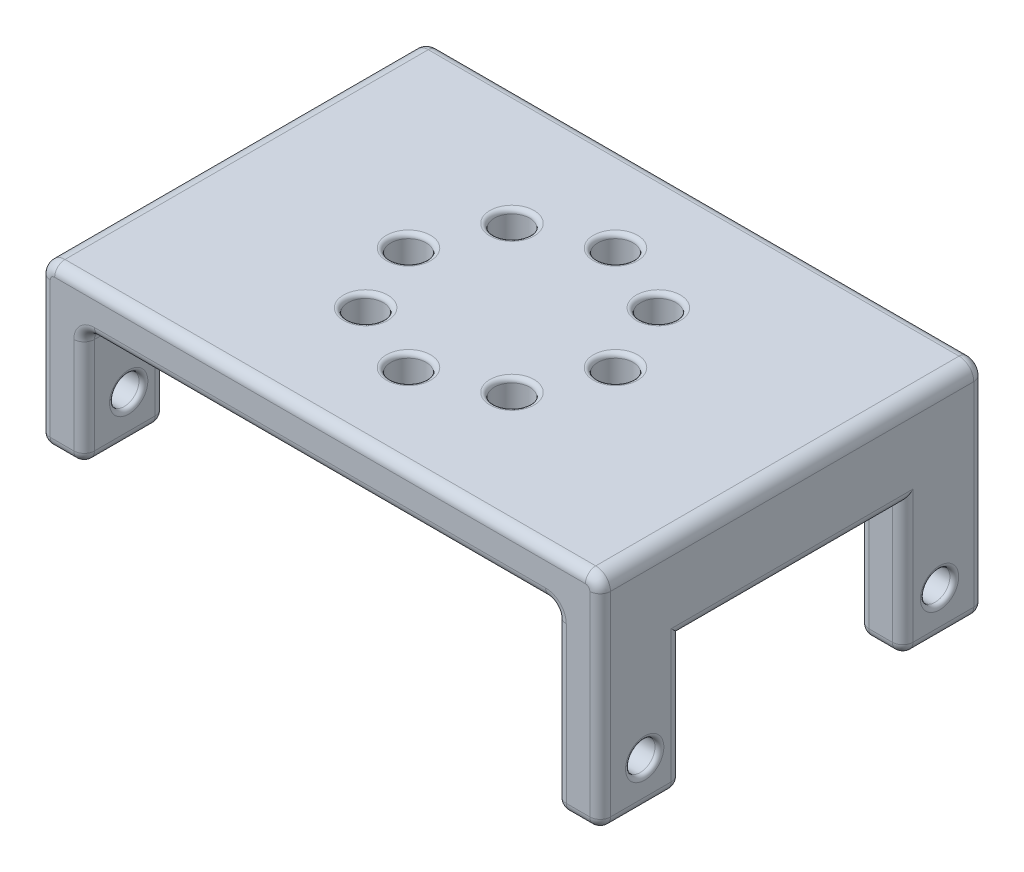
from build123d import *

# Parameters (mm, degrees)
SKETCH1_W           = 38
SKETCH1_H           = 24.04
SKETCH1_R           = 1.2
BOSS_EXTRUDE1_DEPTH = 3
SKETCH2_R           = 1
BOSS_EXTRUDE2_DEPTH = 3
SKETCH3_R           = 1
BOSS_EXTRUDE3_DEPTH = 3
EXTRUDE_1_DEPTH     = 1
EXTRUDE_2_DEPTH     = 1
FILLET_1_R          = 1
FILLET_2_R          = 1
FILLET_3_R          = 0.7
FILLET_4_R          = 0.3


with BuildPart() as part:
    # Sketch1 → Boss-Extrude1 (new body)
    with BuildSketch(Plane(origin=(0, 0, 0), x_dir=(1, 0, 0), z_dir=(0, 1, 0))):
        Rectangle(SKETCH1_W, SKETCH1_H)
        with Locations(Location((0, 7.02, 0), (0, 0, 270))):
            Circle(SKETCH1_R, mode=Mode.SUBTRACT)
        with Locations(Location((4.963889604, 4.963889604, 0), (0, 0, 270))):
            Circle(SKETCH1_R, mode=Mode.SUBTRACT)
        with Locations(Location((7.02, 0, 0), (0, 0, 270))):
            Circle(SKETCH1_R, mode=Mode.SUBTRACT)
        with Locations(Location((4.963889604, -4.963889604, 0), (0, 0, 270))):
            Circle(SKETCH1_R, mode=Mode.SUBTRACT)
        with Locations(Location((0, -7.02, 0), (0, 0, 270))):
            Circle(SKETCH1_R, mode=Mode.SUBTRACT)
        with Locations(Location((-4.963889604, -4.963889604, 0), (0, 0, 270))):
            Circle(SKETCH1_R, mode=Mode.SUBTRACT)
        with Locations(Location((-7.02, 0, 0), (0, 0, 270))):
            Circle(SKETCH1_R, mode=Mode.SUBTRACT)
        with Locations(Location((-4.963889604, 4.963889604, 0), (0, 0, 270))):
            Circle(SKETCH1_R, mode=Mode.SUBTRACT)
    extrude(amount=BOSS_EXTRUDE1_DEPTH)

    # Sketch2 → Boss-Extrude2 (add)
    # profile 1 of 2: a face of its own
    with BuildSketch(Plane(origin=(19, 0, 0), x_dir=(0, 0, -1), z_dir=(1, 0, 0))):
        Polygon((-7.5, -2.95), (0, -2.95), (0, 0), (-12.02, 0), (-12.02, -11.95), (-7.5, -11.95), align=None)
        with Locations((-10, -8.95)):
            Circle(SKETCH2_R, mode=Mode.SUBTRACT)
    # profile 2 of 2: a face of its own
    with BuildSketch(Plane(origin=(19, 0, 0), x_dir=(0, 0, -1), z_dir=(1, 0, 0))):
        Polygon((7.5, -2.95), (7.5, -11.95), (12.02, -11.95), (12.02, 0), (0, 0), (0, -2.95), align=None)
        with Locations((10, -8.95)):
            Circle(SKETCH2_R, mode=Mode.SUBTRACT)
    extrude(amount=-BOSS_EXTRUDE2_DEPTH)

    # Sketch3 → Boss-Extrude3 (add)
    # profile 1 of 2: a face of its own
    with BuildSketch(Plane.ZY.offset(19)):
        Polygon((-7.5, -2.95), (0, -2.95), (0, 0), (-12.02, 0), (-12.02, -7.95), (-7.5, -7.95), align=None)
        with Locations((-10, -4.95)):
            Circle(SKETCH3_R, mode=Mode.SUBTRACT)
    # profile 2 of 2: a face of its own
    with BuildSketch(Plane.ZY.offset(19)):
        Polygon((7.5, -2.95), (7.5, -7.95), (12.02, -7.95), (12.02, 0), (0, 0), (0, -2.95), align=None)
        with Locations((10, -4.95)):
            Circle(SKETCH3_R, mode=Mode.SUBTRACT)
    extrude(amount=-BOSS_EXTRUDE3_DEPTH)

    # 草图1 → 凸台-拉伸1 (add)
    with BuildSketch(Plane.XY.offset(12.02)):
        Polygon((-19, 3), (-19, -7.95), (-16, -7.95), (-16, 0), (16, 0), (16, -11.95), (19, -11.95), (19, 3), align=None)
    extrude(amount=EXTRUDE_1_DEPTH)

    # 草图2 → 凸台-拉伸2 (add)
    with BuildSketch(Plane(origin=(0, 0, -12.02), x_dir=(-1, 0, 0), z_dir=(0, 0, -1))):
        Polygon((-19, 3), (-19, -11.95), (-16, -11.95), (-16, 0), (16, 0), (16, -7.95), (19, -7.95), (19, 3), align=None)
    extrude(amount=EXTRUDE_2_DEPTH)

    # 圆角1
    fillet_1_edges = [part.edges().sort_by_distance(p)[0] for p in [
        (-19, 3, 0),
    ]]
    fillet(fillet_1_edges, radius=FILLET_1_R)

    # 圆角2
    fillet_2_edges = [part.edges().sort_by_distance(p)[0] for p in [
        (19, 3, 0),
    ]]
    fillet(fillet_2_edges, radius=FILLET_2_R)

    # 圆角3
    fillet_3_edges = [part.edges().sort_by_distance(p)[0] for p in [
        (-17.5, -7.95, 13.02),
        (-16, -3.975, 13.02),
        (0, 0, 13.02),
        (16, -5.975, 13.02),
        (17.5, -11.95, 13.02),
        (19, -4.975, 13.02),
        (17.5, -11.95, -13.02),
        (16, -5.975, -13.02),
        (0, 0, -13.02),
        (-16, -3.975, -13.02),
        (-17.5, -7.95, -13.02),
        (-19, -2.975, -13.02),
        (-19, -2.975, 13.02),
        (0, 3, -13.02),
        (-18.707106781, 2.707106781, 13.02),
        (-18.707106781, 2.707106781, -13.02),
        (0, 3, 13.02),
        (19, -4.975, -13.02),
        (18.707106781, 2.707106781, 13.02),
        (18.707106781, 2.707106781, -13.02),
        (16, -2.95, 0),
        (19, -7.45, 7.5),
        (16, -11.95, 10.26),
        (17.5, -11.95, 7.5),
        (16, -11.95, -10.26),
        (16, -7.45, -7.5),
        (17.5, -11.95, -7.5),
        (16, -7.45, 7.5),
        (16, 0, 0),
        (19, -2.95, 0),
        (19, -7.45, -7.5),
        (19, -11.95, -10.26),
        (19, -11.95, 10.26),
        (-16, -2.95, 0),
        (-19, -5.45, -7.5),
        (-16, -7.95, -10.26),
        (-17.5, -7.95, -7.5),
        (-16, -7.95, 10.26),
        (-16, -5.45, 7.5),
        (-17.5, -7.95, 7.5),
        (-16, -5.45, -7.5),
        (-16, 0, 0),
        (-19, -2.95, 0),
        (-19, -5.45, 7.5),
        (-19, -7.95, 10.26),
        (-19, -7.95, -10.26),
    ]]
    fillet(fillet_3_edges, radius=FILLET_3_R)

    # 圆角4
    fillet_4_edges = [part.edges().sort_by_distance(p)[0] for p in [
        (0, 0, -8.22),
        (0, 3, -8.22),
        (4.963889604, 0, -6.163889604),
        (4.963889604, 3, -6.163889604),
        (7.02, 0, -1.2),
        (7.02, 3, -1.2),
        (4.963889604, 0, 3.763889604),
        (4.963889604, 3, 3.763889604),
        (0, 0, 5.82),
        (0, 3, 5.82),
        (-4.963889604, 0, 3.763889604),
        (-4.963889604, 3, 3.763889604),
        (-7.02, 0, -1.2),
        (-7.02, 3, -1.2),
        (-4.963889604, 0, -6.163889604),
        (-4.963889604, 3, -6.163889604),
        (16, -8.95, 11),
        (19, -8.95, -9),
        (16, -8.95, -9),
        (19, -8.95, 11),
        (-16, -4.95, -11),
        (-19, -4.95, 9),
        (-16, -4.95, 9),
        (-19, -4.95, -11),
    ]]
    fillet(fillet_4_edges, radius=FILLET_4_R)


solid = part.part
